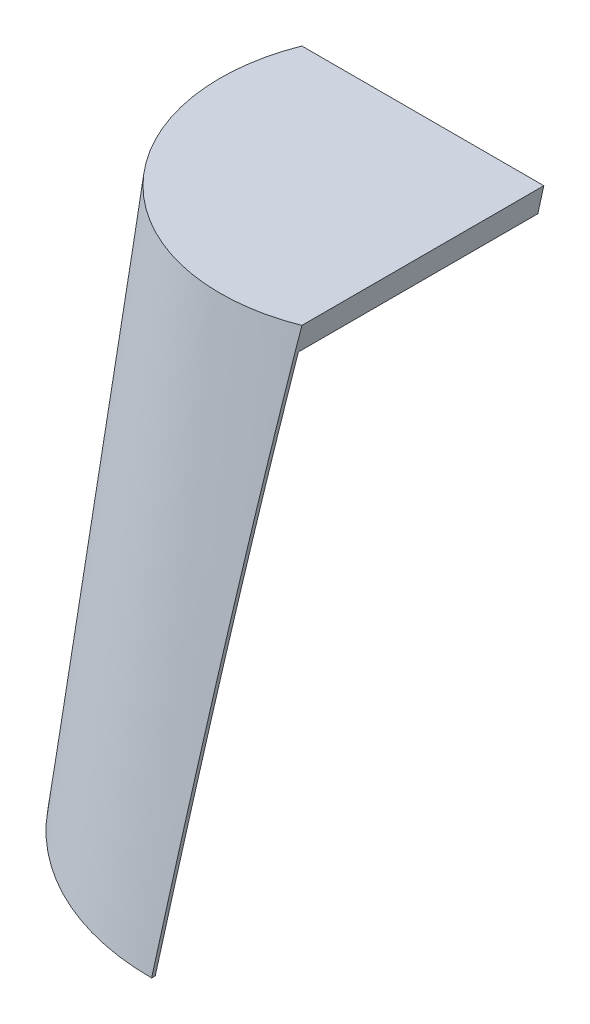
from build123d import *

# Parameters (mm, degrees)
SKETCH2_R           = 105
BOSS_EXTRUDE1_DEPTH = 230
BOSS_EXTRUDE1_TAPER = 7
SKETCH3_R           = 103.5
CUT_EXTRUDE1_DEPTH  = 220
CUT_EXTRUDE1_DRAFT  = -7
CUT_EXTRUDE2_DEPTH  = 230
CUT_EXTRUDE2_DRAFT  = -7


with BuildPart() as part:
    # Sketch2 → Boss-Extrude1 (new body)
    with BuildSketch(Plane(origin=(0, 0, 0), x_dir=(1, 0, 0), z_dir=(0, 1, 0))):
        Circle(SKETCH2_R)
    extrude(amount=BOSS_EXTRUDE1_DEPTH, taper=BOSS_EXTRUDE1_TAPER)


with BuildPart() as cut_extrude1_tool:
    # Sketch3 → Cut-Extrude1 (with draft: the straight prism first)
    with BuildSketch(Plane.XZ):
        Circle(SKETCH3_R)
    extrude(amount=-CUT_EXTRUDE1_DEPTH)
    # Cut-Extrude1: the draft: its side faces are tilted about the plane it starts from
    cut_extrude1_sides = [cut_extrude1_tool.faces().sort_by_distance(p)[0] for p in [
        (-103.5, 110, 0),
    ]]
    draft(cut_extrude1_sides, Plane.XZ, CUT_EXTRUDE1_DRAFT)


with BuildPart() as part_1:
    add(part.part)

    # Cut-Extrude1: cut by cut_extrude1_tool
    add(cut_extrude1_tool.part, mode=Mode.SUBTRACT)


with BuildPart() as cut_extrude2_tool:
    # Sketch4 → Cut-Extrude2 (with draft: the straight prism first)
    with BuildSketch(Plane.XZ):
        with BuildLine():
            ThreePointArc((-105, 0), (74.246212025, -74.246212025), (0, 105))
            Line((0, 105), (0, 0))
            Line((0, 0), (-105, 0))
        make_face()
    extrude(amount=-CUT_EXTRUDE2_DEPTH)
    # Cut-Extrude2: the draft: its side faces are tilted about the plane it starts from
    cut_extrude2_sides = [cut_extrude2_tool.faces().sort_by_distance(p)[0] for p in [
        (74.246212025, 115, -74.246212025),
        (0, 115, 52.5),
        (-52.5, 115, 0),
    ]]
    draft(cut_extrude2_sides, Plane.XZ, CUT_EXTRUDE2_DRAFT)


with BuildPart() as part_2:
    add(part_1.part)

    # Cut-Extrude2: cut by cut_extrude2_tool
    add(cut_extrude2_tool.part, mode=Mode.SUBTRACT)


solid = part_2.part
